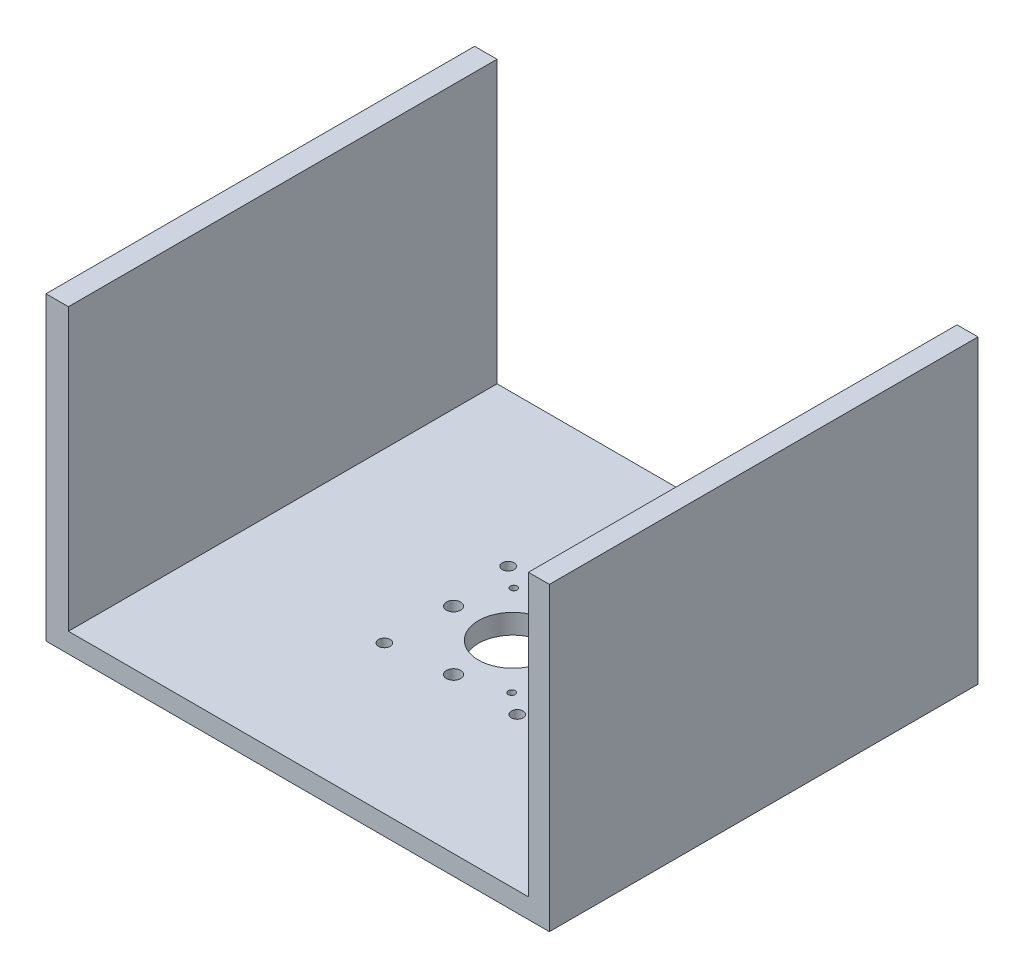
from build123d import *

# Parameters (mm, degrees)
SKETCH1_W             = 5.683554567
SKETCH1_H             = 108.574669318
BOSS_EXTRUDE2_DEPTH   = 76.2
SKETCH1_W_2           = 5.307190744
BOSS_EXTRUDE2_2_DEPTH = 76.2
SKETCH1_5_W           = 116.519157318
SKETCH1_5_H           = 108.574669318
SKETCH1_5_R           = 1.5
SKETCH1_5_R_2         = 1.8
SKETCH1_5_R_3         = 0.875
SKETCH1_5_R_4         = 8.6768437
BOSS_EXTRUDE3_DEPTH   = 5


with BuildPart() as part:
    # Sketch1 → Boss-Extrude2 (new body)
    with BuildSketch(Plane(origin=(0, 0, 0), x_dir=(1, 0, 0), z_dir=(0, 1, 0))):
        with Locations((-61.101355943, 0)):
            Rectangle(SKETCH1_W, SKETCH1_H)
    extrude(amount=BOSS_EXTRUDE2_DEPTH)



with BuildPart() as body_2:
    # Sketch1 → Boss-Extrude2 2 (new body)
    with BuildSketch(Plane(origin=(0, 0, 0), x_dir=(1, 0, 0), z_dir=(0, 1, 0))):
        with Locations((60.913174031, 0)):
            Rectangle(SKETCH1_W_2, SKETCH1_H)
    extrude(amount=BOSS_EXTRUDE2_2_DEPTH)


with BuildPart() as part_1:
    add(part.part)

    add(body_2.part)  # Boss-Extrude3 merges body 2
    # Sketch1<5> → Boss-Extrude3 (add)
    with BuildSketch(Plane(origin=(0, 0, 0), x_dir=(1, 0, 0), z_dir=(0, 1, 0))):
        Rectangle(SKETCH1_5_W, SKETCH1_5_H)
        with Locations((-15.686506038, -16.834299163)):
            Circle(SKETCH1_5_R, mode=Mode.SUBTRACT)
        with Locations((-15, 0)):
            Circle(SKETCH1_5_R_2, mode=Mode.SUBTRACT)
        with Locations((0, -15)):
            Circle(SKETCH1_5_R_2, mode=Mode.SUBTRACT)
        with Locations((16.834299163, -15.686506038)):
            Circle(SKETCH1_5_R, mode=Mode.SUBTRACT)
        with Locations((11.328100331, -11.608727014)):
            Circle(SKETCH1_5_R_3, mode=Mode.SUBTRACT)
        Circle(SKETCH1_5_R_4, mode=Mode.SUBTRACT)
        with Locations((-11.328100331, 11.608727014)):
            Circle(SKETCH1_5_R_3, mode=Mode.SUBTRACT)
        with Locations((-16.834299163, 15.686506038)):
            Circle(SKETCH1_5_R, mode=Mode.SUBTRACT)
        with Locations((15, 0)):
            Circle(SKETCH1_5_R_2, mode=Mode.SUBTRACT)
        with Locations((0, 15)):
            Circle(SKETCH1_5_R_2, mode=Mode.SUBTRACT)
        with Locations((15.686506038, 16.834299163)):
            Circle(SKETCH1_5_R, mode=Mode.SUBTRACT)
    extrude(amount=BOSS_EXTRUDE3_DEPTH)


solid = part_1.part
